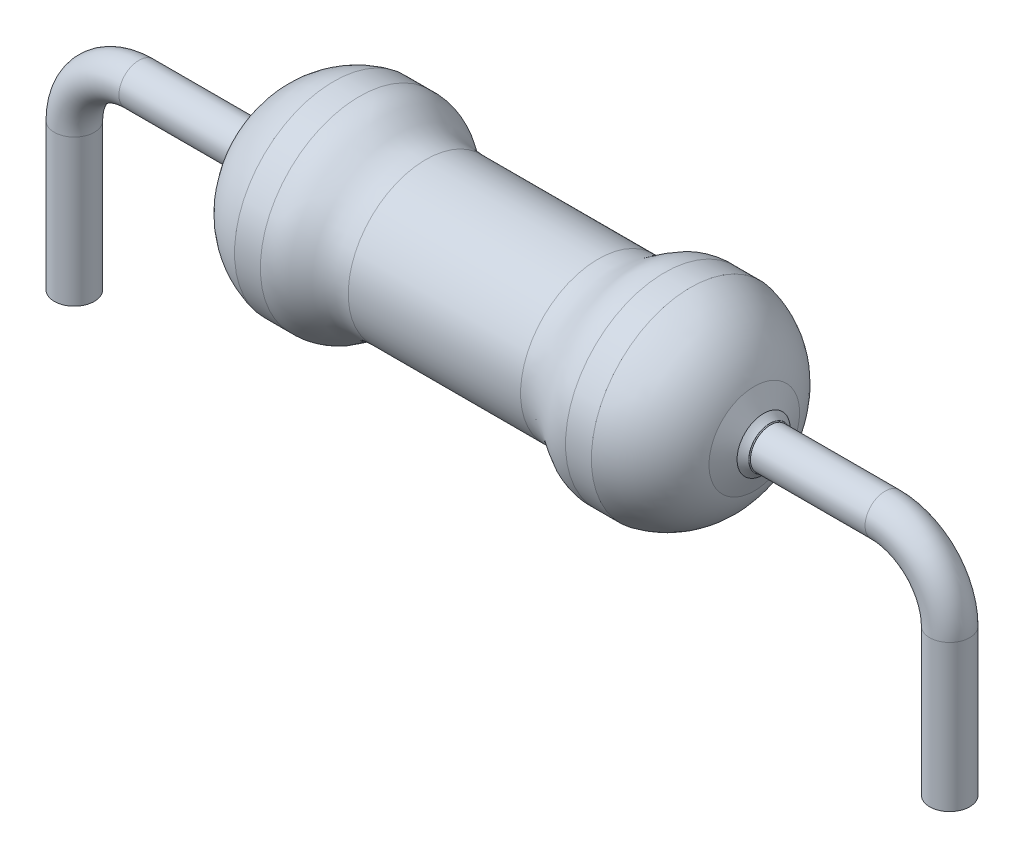
from build123d import *

# Parameters (mm, degrees)
FILLET_2_R = 0.01
CROQUIS5_R = 0.232471002


with BuildPart() as part:
    # Эскиз1 → Повернуть1 (revolve)
    with BuildSketch(Plane.XY, mode=Mode.PRIVATE) as revolve_1_sk:
        with BuildLine():
            Line((3, 0.240314053), (3, 0))
            Line((3, 0), (-3, 0))
            Line((-3, 0), (-3, 0.240314053))
            Line((-3, 0.240314053), (-2.990388227, 0.242672345))
            ThreePointArc((-2.990388227, 0.242672345), (-2.953738282, 0.273776948), (-2.920364738, 0.308373499))
            Line((-2.920364738, 0.308373499), (-2.811874553, 0.525520482))
            ThreePointArc((-2.811874553, 0.525520482), (-2.521743293, 0.933240561), (-2.070714296, 1.15))
            Line((-2.070714296, 1.15), (-1.770714296, 1.15))
            add(Edge.make_bspline(
                [(-1.770714296, 1.15), (-1.391867939, 1.167362108), (-1.378846358, 0.88322734), (-1, 0.900589448)],
                knots=[0, 0, 0, 0, 1, 1, 1, 1], degree=3))
            Line((-1, 0.900589448), (1, 0.900589448))
            add(Edge.make_bspline(
                [(1.770714296, 1.15), (1.391867939, 1.167362108), (1.378846358, 0.88322734), (1, 0.900589448)],
                knots=[0, 0, 0, 0, 1, 1, 1, 1], degree=3))
            Line((1.770714296, 1.15), (2.070714296, 1.15))
            ThreePointArc((2.070714296, 1.15), (2.521743293, 0.933240561), (2.811874553, 0.525520482))
            Line((2.811874553, 0.525520482), (2.920364738, 0.308373499))
            ThreePointArc((2.920364738, 0.308373499), (2.953738282, 0.273776948), (2.990388227, 0.242672345))
            Line((2.990388227, 0.242672345), (3, 0.240314053))
        make_face()
    revolve(revolve_1_sk.sketch.rotate(Axis((26.529158448, 0, 0), (-1, 0, 0)), 90), axis=Axis((26.529158448, 0, 0), (-1, 0, 0)))

    # Скругление2
    fillet_2_edges = [part.edges().sort_by_distance(p)[0] for p in [
        (3, 0, 0.240314053),
        (-3, 0, 0.240314053),
    ]]
    fillet(fillet_2_edges, radius=FILLET_2_R)

    # Barrer1: sweep along a path in Croquis6
    with BuildLine(Plane.XY) as barrer1_path:
        Line((3, 0), (4.33, 0))
        ThreePointArc((4.33, 0), (4.860330086, -0.219669914), (5.08, -0.75))
        Line((5.08, -0.75), (5.08, -2.45))
    # Croquis5 → Barrer1 (sweep)
    with BuildSketch(Plane(origin=(3, 0, 0), x_dir=(0, 0, -1), z_dir=(1, 0, 0))):
        Circle(CROQUIS5_R)
    barrer1 = sweep(path=barrer1_path.line)

    # Simetría1: Barrer1 across plane
    add(barrer1.mirror(Plane(origin=(0, 0, 0), x_dir=(0, 0, 1), z_dir=(1, 0, 0))))


solid = part.part
